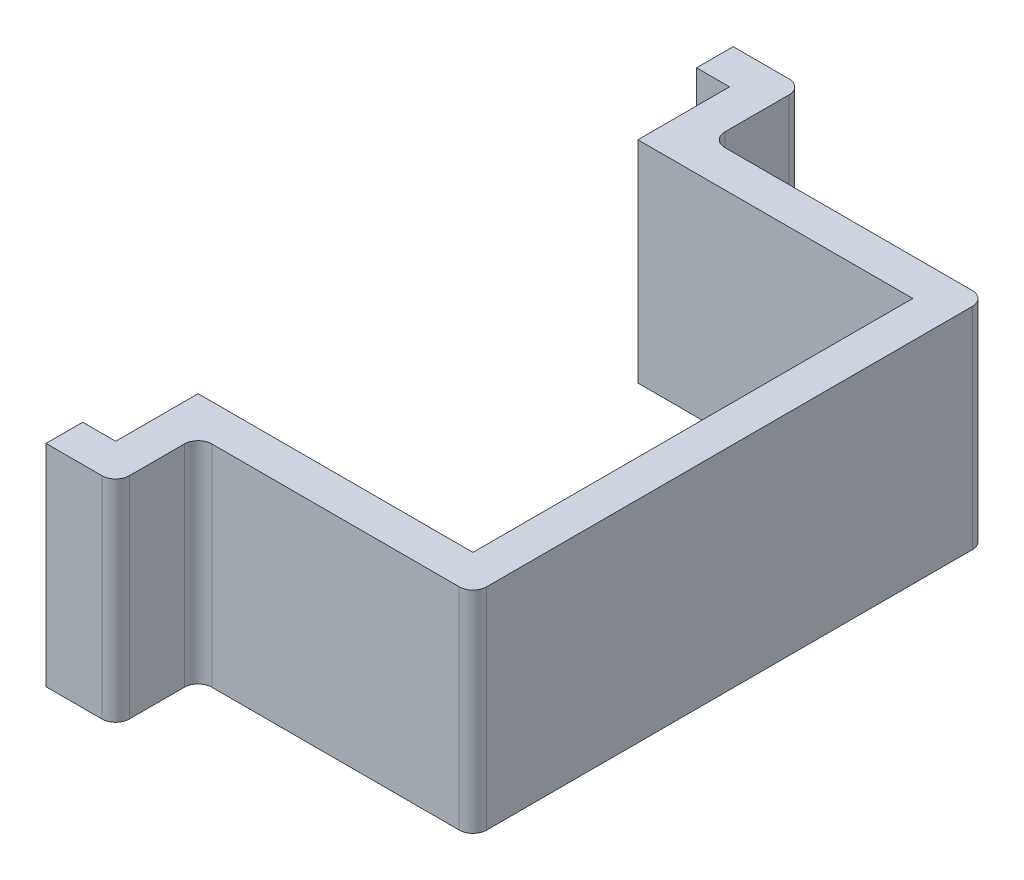
from build123d import *

# Parameters (mm, degrees)
BRACKET_DEPTH = 11.5


with BuildPart() as part:
    # Sketch9 → Bracket (new body)
    with BuildSketch(Plane(origin=(0, 0, 0), x_dir=(1, 0, 0), z_dir=(0, 1, 0))):
        with BuildLine():
            Line((5.15, -5), (4.65, -5))
            Line((4.65, -5), (3.35, -5))
            Line((3.35, -5), (3.35, -7))
            Line((3.35, -7), (6.4, -7))
            ThreePointArc((6.4, -7), (6.930330086, -6.780330086), (7.15, -6.25))
            Line((7.15, -6.25), (7.15, -5))
            Line((7.15, -5), (7.15, -3.25))
            ThreePointArc((7.15, -3.25), (7.369669914, -2.719669914), (7.9, -2.5))
            Line((7.9, -2.5), (21.4, -2.5))
            ThreePointArc((21.4, -2.5), (21.930330086, -2.280330086), (22.15, -1.75))
            Line((22.15, -1.75), (22.15, 24.75))
            ThreePointArc((22.15, 24.75), (21.930330086, 25.280330086), (21.4, 25.5))
            Line((21.4, 25.5), (7.9, 25.5))
            ThreePointArc((7.9, 25.5), (7.369669914, 25.719669914), (7.15, 26.25))
            Line((7.15, 26.25), (7.15, 28))
            Line((7.15, 28), (7.15, 29.75))
            ThreePointArc((7.15, 29.75), (6.930330086, 30.280330086), (6.4, 30.5))
            Line((6.4, 30.5), (5.15, 30.5))
            Line((5.15, 30.5), (3.35, 30.5))
            Line((3.35, 30.5), (3.35, 28.5))
            Line((3.35, 28.5), (5.15, 28.5))
            Line((5.15, 28.5), (5.15, 28))
            Line((5.15, 28), (5.15, 23.5))
            Line((5.15, 23.5), (20.15, 23.5))
            Line((20.15, 23.5), (20.15, -0.5))
            Line((20.15, -0.5), (5.15, -0.5))
            Line((5.15, -0.5), (5.15, -5))
        make_face()
    extrude(amount=BRACKET_DEPTH)


solid = part.part
